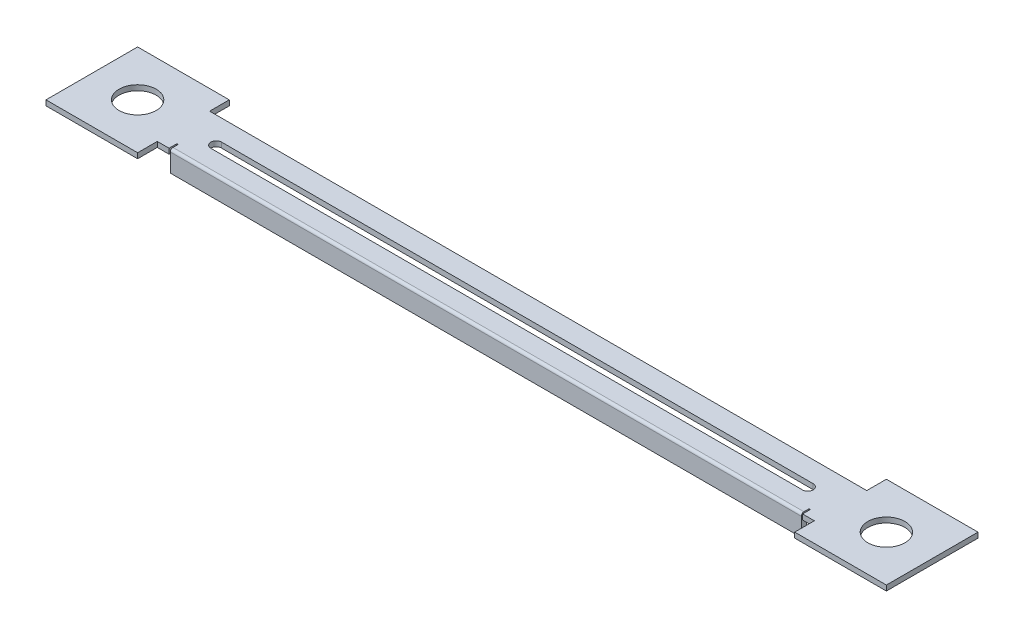
from build123d import *

# Parameters (mm, degrees)
SKETCH1_R           = 7.075
BOSS_EXTRUDE1_DEPTH = 2
SKETCH2_W           = 241
SKETCH2_H           = 2
BOSS_EXTRUDE2_DEPTH = 6
SKETCH3_W           = 0.5
SKETCH3_H           = 2
CUT_EXTRUDE1_DEPTH  = 3
FILLET1_R           = 1
FILLET2_R           = 0.7
CUT_EXTRUDE2_DEPTH  = 305.063315775


with BuildPart() as part:
    # Sketch1 → Boss-Extrude1 (new body)
    with BuildSketch(Plane(origin=(0, 0, 0), x_dir=(1, 0, 0), z_dir=(0, 1, 0))):
        Polygon((-17.5, 17.5), (17.5, 17.5), (17.5, 10), (268.5, 10), (268.5, 17.5), (303.5, 17.5), (303.5, -17.5), (268.5, -17.5), (268.5, -10), (17.5, -10), (17.5, -17.5), (-17.5, -17.5), align=None)
        with Locations(Location((0, 0, 0), (0, 0, 270))):
            Circle(SKETCH1_R, mode=Mode.SUBTRACT)
        with Locations(Location((286, 0, 0), (0, 0, 270))):
            Circle(SKETCH1_R, mode=Mode.SUBTRACT)
    extrude(amount=BOSS_EXTRUDE1_DEPTH)

    # Sketch2 → Boss-Extrude2 (add)
    with BuildSketch(Plane.XZ):
        with Locations((143, 9)):
            Rectangle(SKETCH2_W, SKETCH2_H)
    extrude(amount=BOSS_EXTRUDE2_DEPTH)

    # Sketch3 → Cut-Extrude1 (cut)
    with BuildSketch(Plane.XY.offset(10)):
        with Locations((22.25, 1)):
            Rectangle(SKETCH3_W, SKETCH3_H)
        with Locations((263.75, 1)):
            Rectangle(SKETCH3_W, SKETCH3_H)
    extrude(amount=-CUT_EXTRUDE1_DEPTH, mode=Mode.SUBTRACT)

    # Fillet1
    fillet1_edges = [part.edges().sort_by_distance(p)[0] for p in [
        (143, 2, 10),
    ]]
    fillet(fillet1_edges, radius=FILLET1_R)

    # Fillet2
    fillet2_edges = [part.edges().sort_by_distance(p)[0] for p in [
        (143, 0, 8),
    ]]
    fillet(fillet2_edges, radius=FILLET2_R)

    # Sketch4 → Cut-Extrude2 (cut, through all)
    with BuildSketch(Plane.XZ):
        with BuildLine():
            Line((30, 2.05), (256, 2.05))
            ThreePointArc((256, 2.05), (258.05, 0), (256, -2.05))
            Line((256, -2.05), (30, -2.05))
            ThreePointArc((30, -2.05), (27.95, 0), (30, 2.05))
        make_face()
    extrude(amount=-CUT_EXTRUDE2_DEPTH, mode=Mode.SUBTRACT)


solid = part.part
